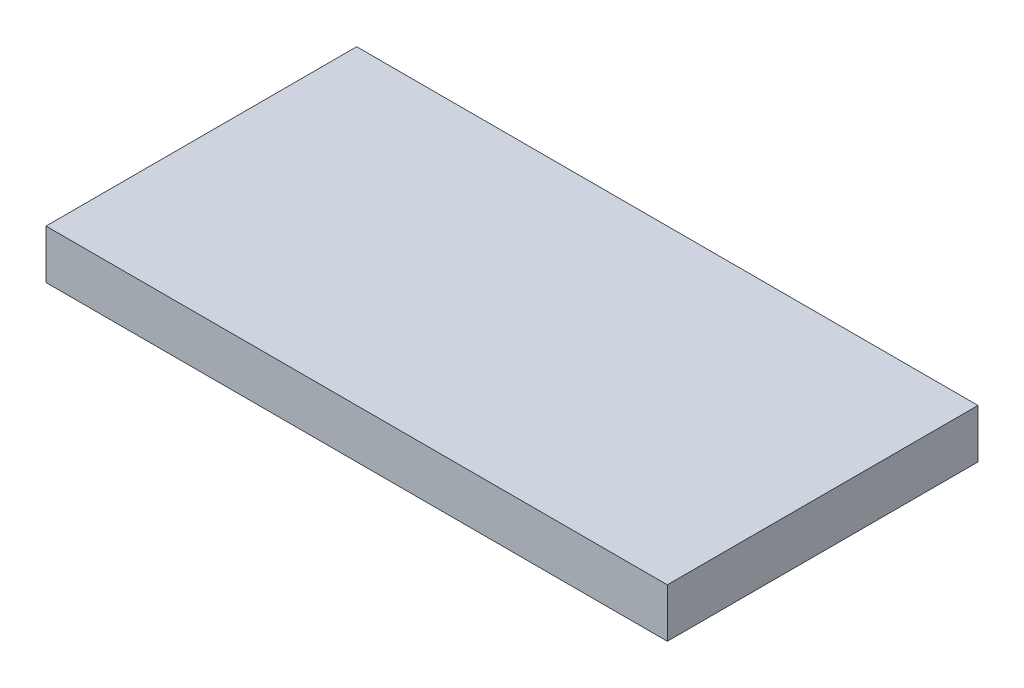
from build123d import *

# Parameters (mm, degrees)
SKETCH_1_W      = 50.8
SKETCH_1_H      = 25.4
EXTRUDE_1_DEPTH = 4


with BuildPart() as part:
    # 草图1 → 凸台-拉伸1 (new body)
    with BuildSketch(Plane(origin=(0, 0, 0), x_dir=(1, 0, 0), z_dir=(0, 1, 0))):
        with Locations((25.4, -12.7)):
            Rectangle(SKETCH_1_W, SKETCH_1_H)
    extrude(amount=EXTRUDE_1_DEPTH)


solid = part.part
